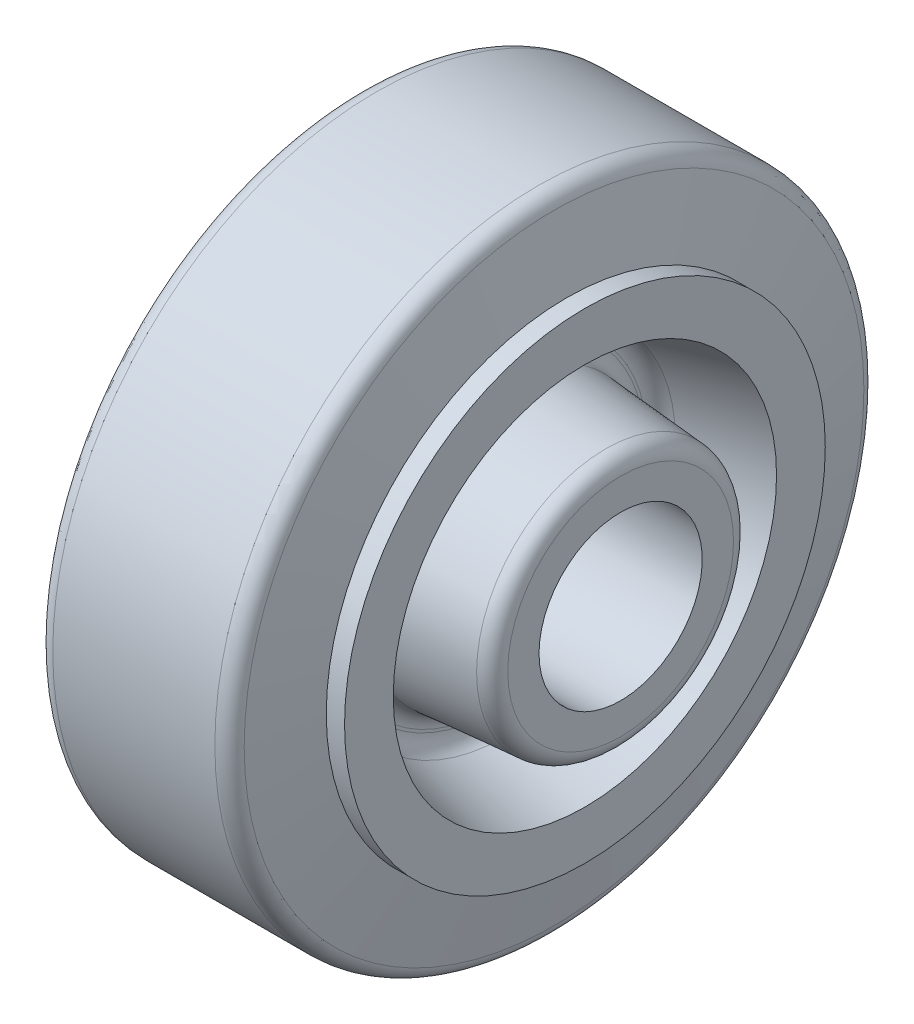
from build123d import *

# Parameters (mm, degrees)
FILLET1_R = 2


with BuildPart() as part:
    # Sketch1 → Revolve1 (revolve)
    with BuildSketch(Plane.XY, mode=Mode.PRIVATE) as revolve1_sk:
        Polygon((-11.65, -39.8), (11.65, -39.8), (13.5, -29.6), (15.75, -29.6), (15.75, -23.6), (4.25, -20.75), (4.25, -17), (20.15, -15.75), (20.15, -10.05), (-20.15, -10.05), (-20.15, -15.75), (-4.25, -17), (-4.25, -20.75), (-15.75, -23.6), (-15.75, -29.6), (-13.5, -29.6), align=None)
    revolve(revolve1_sk.sketch.rotate(Axis((0, 0, 0), (1, 0, 0)), 270), axis=Axis((0, 0, 0), (1, 0, 0)))

    # Fillet1
    fillet1_edges = [part.edges().sort_by_distance(p)[0] for p in [
        (11.65, 0, -39.8),
        (-11.65, 0, -39.8),
        (-4.25, 0, -20.75),
        (-4.25, 0, -17),
        (-20.15, 0, -15.75),
        (20.15, 0, -15.75),
        (4.25, 0, -17),
        (4.25, 0, -20.75),
    ]]
    fillet(fillet1_edges, radius=FILLET1_R)


solid = part.part
